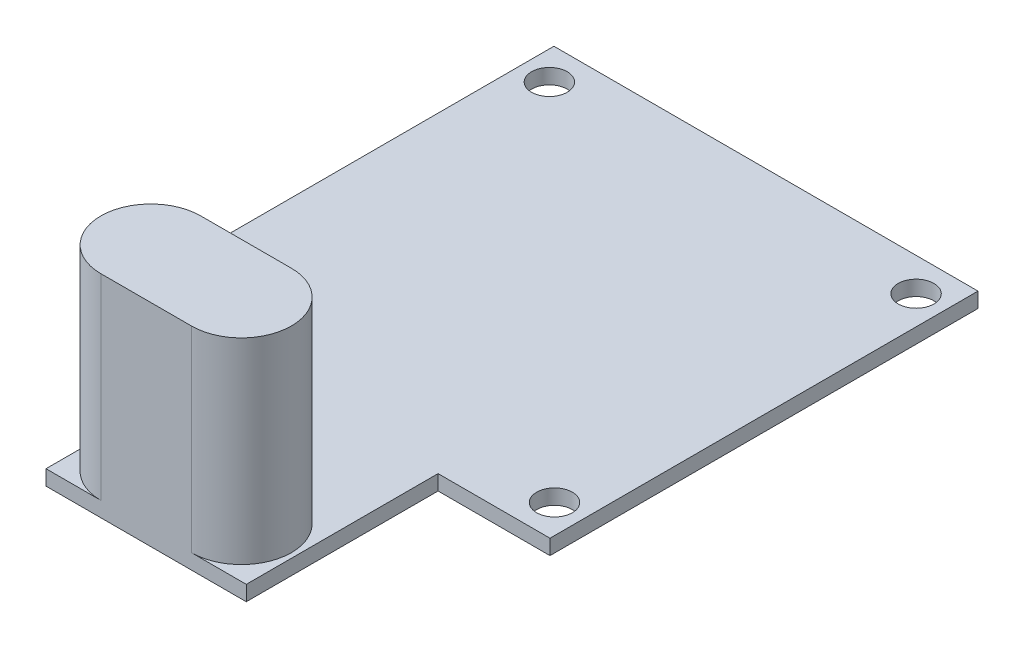
from build123d import *

# Parameters (mm, degrees)
BOSS_EXTRUDE1_DEPTH = 0.635
BOSS_EXTRUDE2_DEPTH = 16.51
CUT_EXTRUDE2_REACH  = 55.289
SKETCH3_R           = 1.49987


with BuildPart() as part:
    # Sketch1 → Boss-Extrude1 (new, symmetric)
    with BuildSketch(Plane(origin=(0, 0, 0), x_dir=(1, 0, 0), z_dir=(0, 1, 0))):
        Polygon((0, 0), (9.4107, 0), (9.4107, -16.129), (26.2509, -16.129), (26.2509, 0), (35.6616, 0), (35.6616, 35.9918), (0, 35.9918), align=None)
    extrude(amount=BOSS_EXTRUDE1_DEPTH, both=True)

    # Sketch2 → Boss-Extrude2 (add)
    with BuildSketch(Plane(origin=(0, 0.635, 0), x_dir=(1, 0, 0), z_dir=(0, 1, 0))):
        with BuildLine():
            Line((14.0208, -7.7216), (21.6408, -7.7216))
            ThreePointArc((21.6408, -7.7216), (25.8445, -11.9253), (21.6408, -16.129))
            Line((21.6408, -16.129), (14.0208, -16.129))
            ThreePointArc((14.0208, -16.129), (9.8171, -11.9253), (14.0208, -7.7216))
        make_face()
    extrude(amount=BOSS_EXTRUDE2_DEPTH)

    # Sketch3 → Cut-Extrude2 (cut, up to next)
    with BuildSketch(Plane(origin=(0, 0.635, 0), x_dir=(1, 0, 0), z_dir=(0, 1, 0)), mode=Mode.PRIVATE) as cut_extrude2_sk1:
        with Locations(Location((2.413, 33.1978, 0), (0, 0, 270))):
            Circle(SKETCH3_R)
    cut_extrude2_tool1 = extrude(cut_extrude2_sk1.sketch, amount=-CUT_EXTRUDE2_REACH, mode=Mode.PRIVATE) & part.part
    # Sketch3 → Cut-Extrude2 (cut, up to next)
    with BuildSketch(Plane(origin=(0, 0.635, 0), x_dir=(1, 0, 0), z_dir=(0, 1, 0)), mode=Mode.PRIVATE) as cut_extrude2_sk2:
        with Locations(Location((2.413, 2.794, 0), (0, 0, 90))):
            Circle(SKETCH3_R)
    cut_extrude2_tool2 = extrude(cut_extrude2_sk2.sketch, amount=-CUT_EXTRUDE2_REACH, mode=Mode.PRIVATE) & part.part
    # Sketch3 → Cut-Extrude2 (cut, up to next)
    with BuildSketch(Plane(origin=(0, 0.635, 0), x_dir=(1, 0, 0), z_dir=(0, 1, 0)), mode=Mode.PRIVATE) as cut_extrude2_sk3:
        with Locations(Location((33.2486, 2.794, 0), (0, 0, 270))):
            Circle(SKETCH3_R)
    cut_extrude2_tool3 = extrude(cut_extrude2_sk3.sketch, amount=-CUT_EXTRUDE2_REACH, mode=Mode.PRIVATE) & part.part
    # Sketch3 → Cut-Extrude2 (cut, up to next)
    with BuildSketch(Plane(origin=(0, 0.635, 0), x_dir=(1, 0, 0), z_dir=(0, 1, 0)), mode=Mode.PRIVATE) as cut_extrude2_sk4:
        with Locations(Location((33.2486, 33.1978, 0), (0, 0, 90))):
            Circle(SKETCH3_R)
    cut_extrude2_tool4 = extrude(cut_extrude2_sk4.sketch, amount=-CUT_EXTRUDE2_REACH, mode=Mode.PRIVATE) & part.part
    add(cut_extrude2_tool1.solids().sort_by_distance((2.413, 0.635, -33.1978))[0], mode=Mode.SUBTRACT)
    add(cut_extrude2_tool2.solids().sort_by_distance((2.413, 0.635, -2.794))[0], mode=Mode.SUBTRACT)
    add(cut_extrude2_tool3.solids().sort_by_distance((33.2486, 0.635, -2.794))[0], mode=Mode.SUBTRACT)
    add(cut_extrude2_tool4.solids().sort_by_distance((33.2486, 0.635, -33.1978))[0], mode=Mode.SUBTRACT)


solid = part.part
